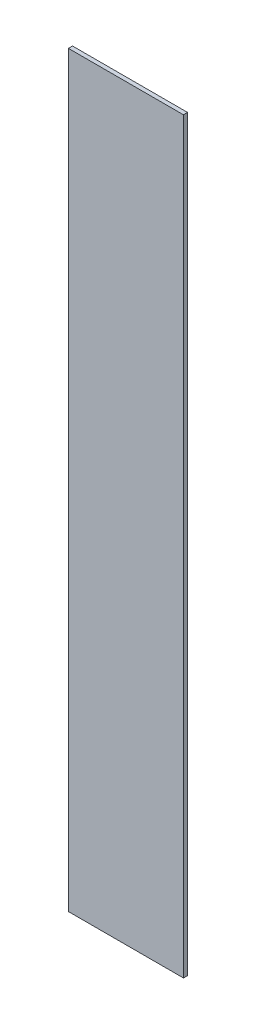
from build123d import *

# Parameters (mm, degrees)
OVEN_PANO_KAPAGI_KULP_CUKURU_1_START = 26
SKETCH1_W                            = 28
SKETCH1_H                            = 182
OVEN_PANO_KAPAGI_KULP_CUKURU_1_DEPTH = 1


with BuildPart() as part:
    # Sketch1 → OVEN_pano_kapagi_kulp_cukuru_1 (new body)
    with BuildSketch(Plane.XY.offset(OVEN_PANO_KAPAGI_KULP_CUKURU_1_START)):
        with Locations((637, 220)):
            Rectangle(SKETCH1_W, SKETCH1_H)
    extrude(amount=OVEN_PANO_KAPAGI_KULP_CUKURU_1_DEPTH)


solid = part.part
